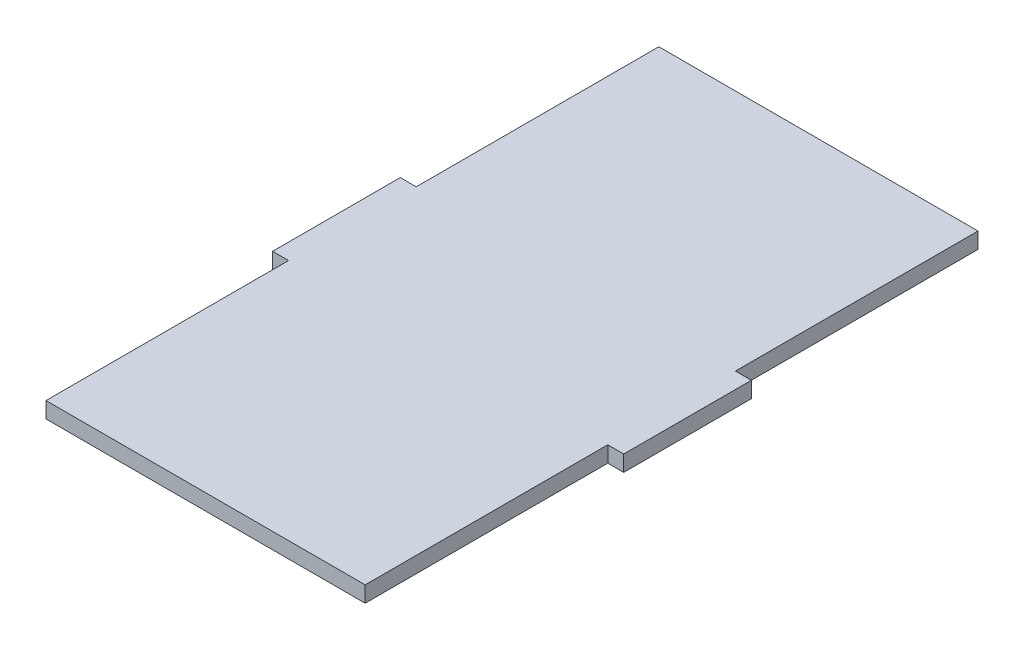
from build123d import *

# Parameters (mm, degrees)
BOSS_EXTRUDE1_DEPTH = 3.175


with BuildPart() as part:
    # Sketch1 → Boss-Extrude1 (new body)
    with BuildSketch(Plane(origin=(0, 0, 0), x_dir=(1, 0, 0), z_dir=(0, 1, 0))):
        Polygon((3.175, -29.21), (66.675, -29.21), (66.675, 19.05), (69.85, 19.05), (69.85, 44.45), (66.675, 44.45), (66.675, 92.71), (3.175, 92.71), (3.175, 44.45), (0, 44.45), (0, 19.05), (3.175, 19.05), align=None)
    extrude(amount=BOSS_EXTRUDE1_DEPTH)


solid = part.part
